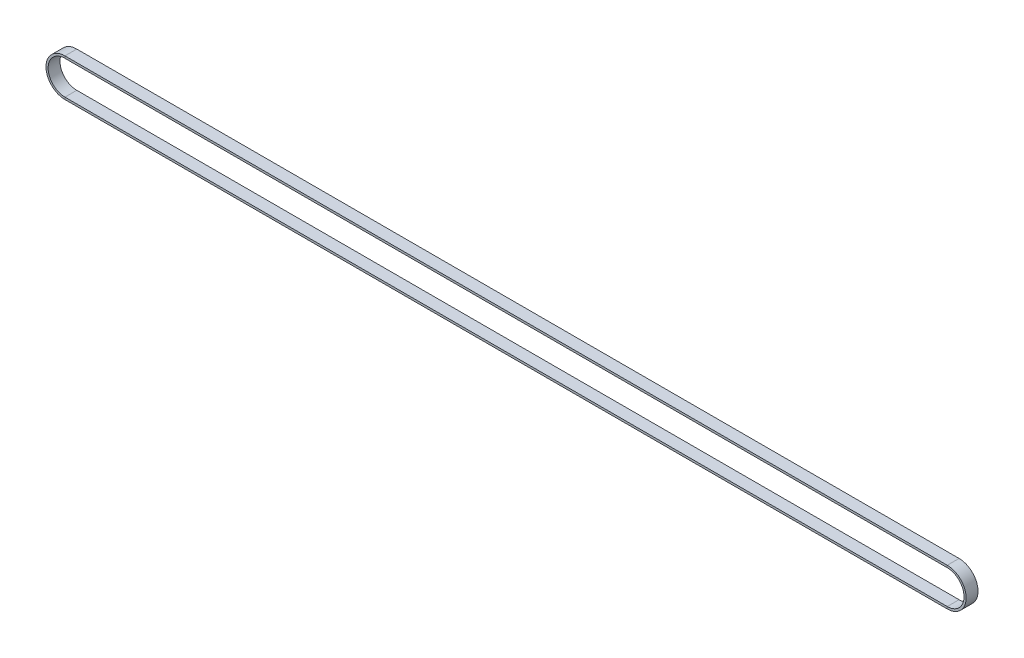
from build123d import *

# Parameters (mm, degrees)
SKETCH3_W = 6.35
SKETCH3_H = 1.143


with BuildPart() as part:
    # Sweep1: sweep along a path in Sketch2
    with BuildLine(Plane.XY) as sweep1_path:
        Line((4.7625, 3.801312013), (478.30391864, 3.801312013))
        ThreePointArc((478.30391864, 3.801312013), (488.46391864, -6.358687987), (478.30391864, -16.518687987))
        Line((478.30391864, -16.518687987), (4.7625, -16.518687987))
        ThreePointArc((4.7625, -16.518687987), (-5.3975, -6.358687987), (4.7625, 3.801312013))
    # Sketch3 → Sweep1 (sweep)
    with BuildSketch(Plane(origin=(4.7625, 3.801312013, 0), x_dir=(0, 0, -1), z_dir=(1, 0, 0))):
        with Locations((0, -0.5715)):
            Rectangle(SKETCH3_W, SKETCH3_H)
    sweep(path=sweep1_path.line)


solid = part.part
